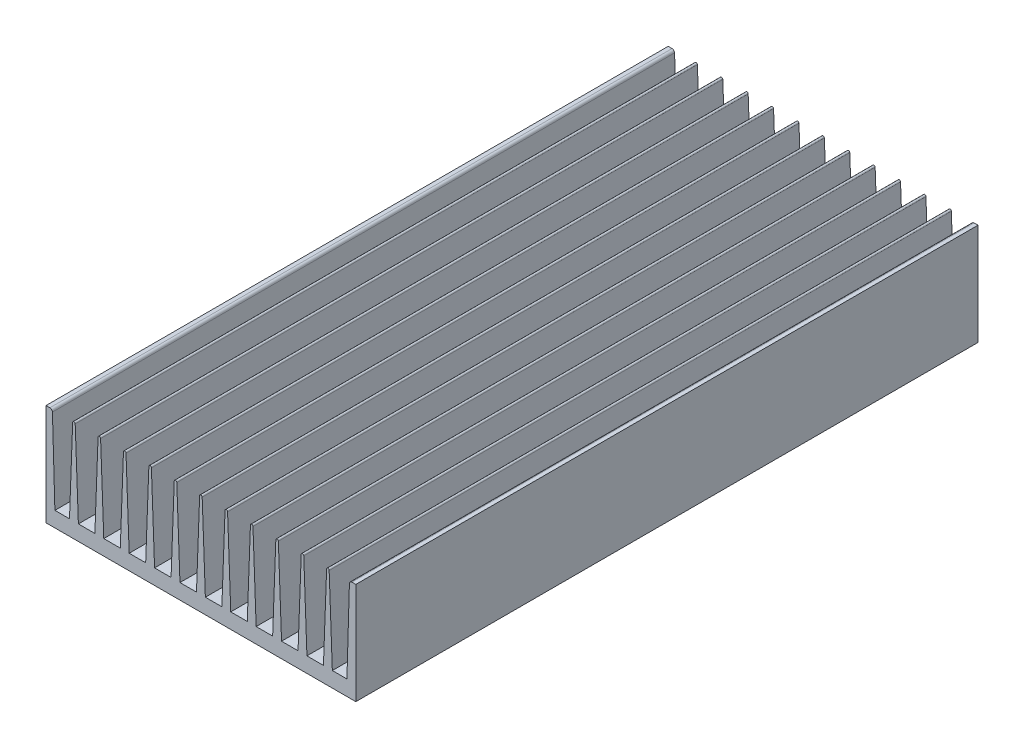
from build123d import *

# Parameters (mm, degrees)
EXTRUDE_1_DEPTH       = 245
EXTRUDE_3_DEPTH       = 245
PATTERN_CURVE_1_COUNT = 11
PATTERN_CURVE_1_PITCH = 10
SKETCH_3_R            = 1.6
CUT_EXTRUDE_1_DEPTH   = 6


with BuildPart() as part:
    # Эскиз1 → Вытянуть1 (new body)
    with BuildSketch(Plane.XY):
        with BuildLine():
            Line((0, 40), (1.528979332, 40))
            ThreePointArc((1.528979332, 40), (2.225614441, 39.717425624), (2.528547087, 39.029399052))
            Line((2.528547087, 39.029399052), (3.5, 6))
            Line((3.5, 6), (118.5, 6))
            Line((118.5, 6), (119.471452913, 39.029399052))
            ThreePointArc((119.471452913, 39.029399052), (119.774385559, 39.717425624), (120.471020668, 40))
            Line((120.471020668, 40), (122, 40))
            Line((122, 40), (122, 0))
            Line((122, 0), (0, 0))
            Line((0, 0), (0, 40))
        make_face()
    extrude(amount=EXTRUDE_1_DEPTH)

    # Эскиз2 → Вытянуть3 (add)
    with BuildSketch(Plane.XY.offset(245)):
        with BuildLine():
            Line((10.5, 39.5), (9.25, 6))
            Line((9.25, 6), (12.75, 6))
            Line((12.75, 6), (11.5, 39.5))
            ThreePointArc((11.5, 39.5), (11, 40), (10.5, 39.5))
        make_face()
    extrude_3 = extrude(amount=-EXTRUDE_3_DEPTH)

    # Кривая1: Вытянуть3 ×11
    with Locations(*[(i * PATTERN_CURVE_1_PITCH, 0, 0) for i in range(1, PATTERN_CURVE_1_COUNT)]):
        add(extrude_3)

    # Эскиз3 → Вырез-Вытянуть1 (cut)
    with BuildSketch(Plane.XZ):
        with Locations((22, 236.5)):
            Circle(SKETCH_3_R)
        with Locations((102, 236.5)):
            Circle(SKETCH_3_R)
        with Locations(Location((102, 8.5, 0), (0, 0, 62.046813117))):
            Circle(SKETCH_3_R)
        with Locations(Location((22, 8.5, 0), (0, 0, 62.046813117))):
            Circle(SKETCH_3_R)
    extrude(amount=-CUT_EXTRUDE_1_DEPTH, mode=Mode.SUBTRACT)


solid = part.part
